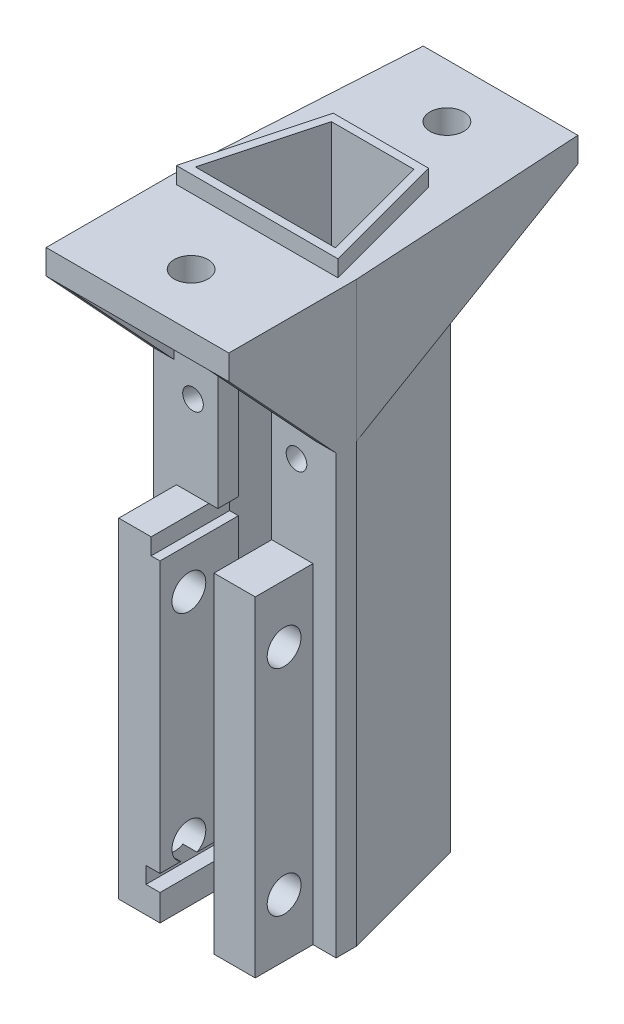
from build123d import *

# Parameters (mm, degrees)
SKETCH2_W                = 5
SKETCH2_H                = 7
BOSS_EXTRUDE1_DEPTH      = 40
SKETCH3_R                = 2.05
CUT_EXTRUDE2_DEPTH       = 40
BOSS_EXTRUDE2_DEPTH      = 30
SKETCH7_W                = 4.5
SKETCH7_H                = 2
CUT_EXTRUDE3_DEPTH       = 76.328383431
SKETCH8_W                = 1.7
SKETCH8_H                = 2
CUT_EXTRUDE4_DEPTH       = 73.729741855
SKETCH9_W                = 6.543059906
SKETCH9_H                = 1
BOSS_EXTRUDE3_DEPTH      = 2
SKETCH10_W               = 4.5
SKETCH10_H               = 75
CUT_EXTRUDE5_DEPTH       = 1.5
SKETCH13_W               = 2.8
SKETCH13_H               = 2
CUT_EXTRUDE7_DEPTH       = 1.5
SKETCH15_W               = 1.5
SKETCH15_H               = 2
CUT_EXTRUDE8_DEPTH       = 18.5
SKETCH16_R               = 1.25
CUT_EXTRUDE9_DEPTH       = 3.5
SKETCH17_R               = 1.25
CUT_EXTRUDE10_DEPTH      = 3.5
SKETCH18_W               = 22.143059906
SKETCH18_H               = 3
BOSS_EXTRUDE4_DEPTH      = 15.5
BOSS_EXTRUDE5_DEPTH      = 13
BOSS_EXTRUDE5_DEPTH_BACK = 2
SKETCH19_W               = 13.83663494
SKETCH19_H               = 3
BOSS_EXTRUDE6_DEPTH      = 2.5
BOSS_EXTRUDE8_DEPTH      = 2.5
BOSS_EXTRUDE9_DEPTH      = 4.2
BOSS_EXTRUDE10_DEPTH     = 4.2
SKETCH25_R               = 2.05
CUT_EXTRUDE12_DEPTH      = 3.5
CUT_EXTRUDE13_DEPTH      = 71.528016285
CUT_EXTRUDE14_DEPTH      = 71.528016285


with BuildPart() as part:
    # Sketch2 → Boss-Extrude1 (new body)
    with BuildSketch(Plane(origin=(0, 0, 0), x_dir=(1, 0, 0), z_dir=(0, 1, 0))):
        Polygon((9.921548121, -11.656419986), (5.768335638, 3.843580014), (5.768335638, 1.343580014), (3.850018168, 1.343580014), (7.33335767, -11.656419986), align=None)
        Polygon((5.768335638, 3.843580014), (-8.068299302, 3.843580014), (-5.653484736, 3.196532402), (-6.149981832, 1.343580014), (3.850018168, 1.343580014), (3.353521072, 3.196532402), align=None)
        Polygon((-8.068299302, 1.343580014), (-8.068299302, 3.843580014), (-12.221511785, -11.656419986), (-9.633321334, -11.656419986), (-6.149981832, 1.343580014), align=None)
        Polygon((5.768335638, 1.343580014), (5.768335638, 3.843580014), (3.353521072, 3.196532402), (3.850018168, 1.343580014), align=None)
        Polygon((-5.653484736, 3.196532402), (-8.068299302, 3.843580014), (-8.068299302, 1.343580014), (-6.149981832, 1.343580014), align=None)
        Polygon((-9.806697219, -12.303467598), (-12.221511785, -11.656419986), (-12.221511785, -14.156419986), (-9.421511785, -14.156419986), (-4.421511785, -14.156419986), (-4.421511785, -11.656419986), (-9.633321334, -11.656419986), align=None)
        Polygon((-9.633321334, -11.656419986), (-12.221511785, -11.656419986), (-9.806697219, -12.303467598), align=None)
        Polygon((7.506733555, -12.303467598), (9.921548121, -11.656419986), (7.33335767, -11.656419986), align=None)
        Polygon((9.921548121, -14.156419986), (9.921548121, -11.656419986), (7.506733555, -12.303467598), (7.33335767, -11.656419986), (2.121548121, -11.656419986), (2.121548121, -14.156419986), (7.121548121, -14.156419986), align=None)
        with Locations((4.621548121, -17.656419986)):
            Rectangle(SKETCH2_W, SKETCH2_H)
        with Locations((-6.921511785, -17.656419986)):
            Rectangle(SKETCH2_W, SKETCH2_H)
    extrude(amount=BOSS_EXTRUDE1_DEPTH)

    # Sketch3 → Cut-Extrude2 (cut)
    with BuildSketch(Plane.ZY.offset(9.421511785)):
        with Locations((17.656419986, 33)):
            Circle(SKETCH3_R)
        with Locations((17.656419986, 7)):
            Circle(SKETCH3_R)
    extrude(amount=-CUT_EXTRUDE2_DEPTH, mode=Mode.SUBTRACT)

    # Sketch4 → Boss-Extrude2 (add)
    with BuildSketch(Plane(origin=(0, 40, 0), x_dir=(1, 0, 0), z_dir=(0, 1, 0))):
        Polygon((-4.421511785, -11.656419986), (-9.633321334, -11.656419986), (-6.149981832, 1.343580014), (3.850018168, 1.343580014), (7.33335767, -11.656419986), (2.121548121, -11.656419986), (2.121548121, -14.156419986), (7.121548121, -14.156419986), (9.921548121, -14.156419986), (9.921548121, -11.656419986), (5.768335638, 3.843580014), (-8.068299302, 3.843580014), (-12.221511785, -11.656419986), (-12.221511785, -14.156419986), (-9.421511785, -14.156419986), (-4.421511785, -14.156419986), align=None)
    extrude(amount=BOSS_EXTRUDE2_DEPTH)

    # Sketch7 → Cut-Extrude3 (cut, through all)
    with BuildSketch(Plane(origin=(0, 0, -3.843580014), x_dir=(-1, 0, 0), z_dir=(0, 0, -1))):
        with Locations((3.241664362, 39)):
            Rectangle(SKETCH7_W, SKETCH7_H)
    extrude(amount=-CUT_EXTRUDE3_DEPTH, mode=Mode.SUBTRACT)

    # Sketch8 → Cut-Extrude4 (cut, through all)
    with BuildSketch(Plane(origin=(0, 0, 11.656419986), x_dir=(-1, 0, 0), z_dir=(0, 0, -1))):
        with Locations((5.271511785, 4.2)):
            Rectangle(SKETCH8_W, SKETCH8_H)
    extrude(amount=-CUT_EXTRUDE4_DEPTH, mode=Mode.SUBTRACT)

    # Sketch9 → Boss-Extrude3 (add)
    with BuildSketch(Plane(origin=(0, 70, 0), x_dir=(1, 0, 0), z_dir=(0, 1, 0))):
        Polygon((7.33335767, -11.656419986), (2.121548121, -11.656419986), (2.121548121, -12.656419986), (8.636583042, -12.656419986), (4.617345156, 2.343580014), (-6.91730882, 2.343580014), (-10.936546706, -12.656419986), (-4.421511785, -12.656419986), (-4.421511785, -11.656419986), (-9.633321334, -11.656419986), (-6.149981832, 1.343580014), (3.850018168, 1.343580014), align=None)
        with Locations((-1.149981832, -12.156419986)):
            Rectangle(SKETCH9_W, SKETCH9_H)
    extrude(amount=BOSS_EXTRUDE3_DEPTH)

    # Sketch10 → Cut-Extrude5 (cut)
    with BuildSketch(Plane(origin=(0, 0, -3.843580014), x_dir=(-1, 0, 0), z_dir=(0, 0, -1))):
        with Locations((3.241664362, 77.5)):
            Rectangle(SKETCH10_W, SKETCH10_H)
    extrude(amount=-CUT_EXTRUDE5_DEPTH, mode=Mode.SUBTRACT)

    # Sketch13 → Cut-Extrude7 (cut)
    with BuildSketch(Plane(origin=(0, 0, -2.343580014), x_dir=(-1, 0, 0), z_dir=(0, 0, -1))):
        with Locations((6.891664362, 41)):
            Rectangle(SKETCH13_W, SKETCH13_H)
    extrude(amount=CUT_EXTRUDE7_DEPTH, mode=Mode.SUBTRACT)

    # Sketch15 → Cut-Extrude8 (cut, along a direction that is not the sketch's normal)
    with BuildSketch(Plane(origin=(0, 0, -3.843580014), x_dir=(-1, 0, 0), z_dir=(0, 0, -1))):
        with Locations((7.318299302, 41)):
            Rectangle(SKETCH15_W, SKETCH15_H)
    extrude(amount=-CUT_EXTRUDE8_DEPTH, dir=(0.25881904510252474, 0, -0.9659258262890672), mode=Mode.SUBTRACT)

    # Sketch16 → Cut-Extrude9 (cut, along a direction that is not the sketch's normal)
    with BuildSketch(Plane.XY.offset(14.156419986)):
        with Locations((-7.421511785, 50)):
            Circle(SKETCH16_R)
    extrude(amount=-CUT_EXTRUDE9_DEPTH, dir=(-0.2588190451025246, 0, 0.9659258262890672), mode=Mode.SUBTRACT)

    # Sketch17 → Cut-Extrude10 (cut, along a direction that is not the sketch's normal)
    with BuildSketch(Plane.XY.offset(14.156419986)):
        with Locations((5.121548121, 50)):
            Circle(SKETCH17_R)
    extrude(amount=-CUT_EXTRUDE10_DEPTH, dir=(0.25881904510251796, 0, 0.9659258262890691), mode=Mode.SUBTRACT)

    # Sketch18 → Boss-Extrude4 (add)
    with BuildSketch(Plane(origin=(0, 0, 11.656419986), x_dir=(-1, 0, 0), z_dir=(0, 0, -1))):
        with Locations((1.149981832, 68.5)):
            Rectangle(SKETCH18_W, SKETCH18_H)
    extrude(amount=-BOSS_EXTRUDE4_DEPTH)

    # Sketch19 → Boss-Extrude5 (add, two sides: drawn at the far end of the back side and taken through both)
    with BuildSketch(Plane(origin=(0, 0, -3.843580014), x_dir=(-1, 0, 0), z_dir=(0, 0, -1)).offset(-BOSS_EXTRUDE5_DEPTH_BACK)):
        with Locations((1.149981832, 68.5)):
            Rectangle(SKETCH19_W, SKETCH19_H)
    extrude(amount=BOSS_EXTRUDE5_DEPTH + BOSS_EXTRUDE5_DEPTH_BACK)

    # Sketch21 → Boss-Extrude6 (add)
    with BuildSketch(Plane.ZY.offset(12.221511785)):
        Polygon((27.156419986, 67), (14.156419986, 53), (14.156419986, 67), align=None)
    extrude(amount=-BOSS_EXTRUDE6_DEPTH)

    # Sketch22 → Boss-Extrude8 (add)
    with BuildSketch(Plane(origin=(9.921548121, 0, 0), x_dir=(0, 0, -1), z_dir=(1, 0, 0))):
        Polygon((-27.156419986, 67), (-14.156419986, 67), (-14.156419986, 53), align=None)
    extrude(amount=-BOSS_EXTRUDE8_DEPTH)

    # Sketch23 → Boss-Extrude9 (add)
    with BuildSketch(Plane(origin=(9.921548121, 0, 0), x_dir=(0, 0, -1), z_dir=(1, 0, 0))):
        Polygon((-11.656419986, 70), (-11.656419986, 53), (16.843580014, 67), (16.843580014, 70), align=None)
    extrude(amount=-BOSS_EXTRUDE9_DEPTH)

    # Sketch24 → Boss-Extrude10 (add)
    with BuildSketch(Plane.ZY.offset(12.221511785)):
        Polygon((11.656419986, 70), (-16.843580014, 70), (-16.843580014, 67), (11.656419986, 53), align=None)
    extrude(amount=-BOSS_EXTRUDE10_DEPTH)

    # Sketch25 → Cut-Extrude12 (cut)
    with BuildSketch(Plane(origin=(0, 70, 0), x_dir=(1, 0, 0), z_dir=(0, 1, 0))):
        with Locations(Location((-1.149981694, 10.343580014, 0), (0, 0, 270))):
            Circle(SKETCH25_R)
        with Locations(Location((-1.149981723, -20.656419986, 0), (0, 0, 270))):
            Circle(SKETCH25_R)
    extrude(amount=-CUT_EXTRUDE12_DEPTH, mode=Mode.SUBTRACT)

    # Sketch26 → Cut-Extrude13 (cut, through all, along a direction that is not the sketch's normal)
    with BuildSketch(Plane(origin=(0, 47.309855268, 23.239928904), x_dir=(-1, 0, 0), z_dir=(-4.742047126241555e-14, -0.8975543264374147, -0.4409038796534669))):
        Polygon((-5.721548121, 12.905635433), (-7.33335767, 12.905635433), (-5.721548121, 19.607575306), align=None)
        Polygon((8.021511785, 12.905635433), (8.021511785, 19.607575306), (9.633321334, 12.905635433), align=None)
    extrude(amount=-CUT_EXTRUDE13_DEPTH, dir=(0, -1, 0), mode=Mode.SUBTRACT)

    # Sketch27 → Cut-Extrude14 (cut, through all, along a direction that is not the sketch's normal)
    with BuildSketch(Plane(origin=(0, 47.309855268, 23.239928904), x_dir=(-1, 0, 0), z_dir=(0, -0.8975543264374147, -0.440903879653467))):
        Polygon((12.221511785, 12.905635433), (10.521511785, 44.658588051), (12.221511785, 44.658588051), align=None)
        Polygon((-9.921548121, 12.905635433), (-9.921548121, 44.658588051), (-8.221548121, 44.658588051), align=None)
    extrude(amount=-CUT_EXTRUDE14_DEPTH, dir=(0, -1, 0), mode=Mode.SUBTRACT)


solid = part.part
